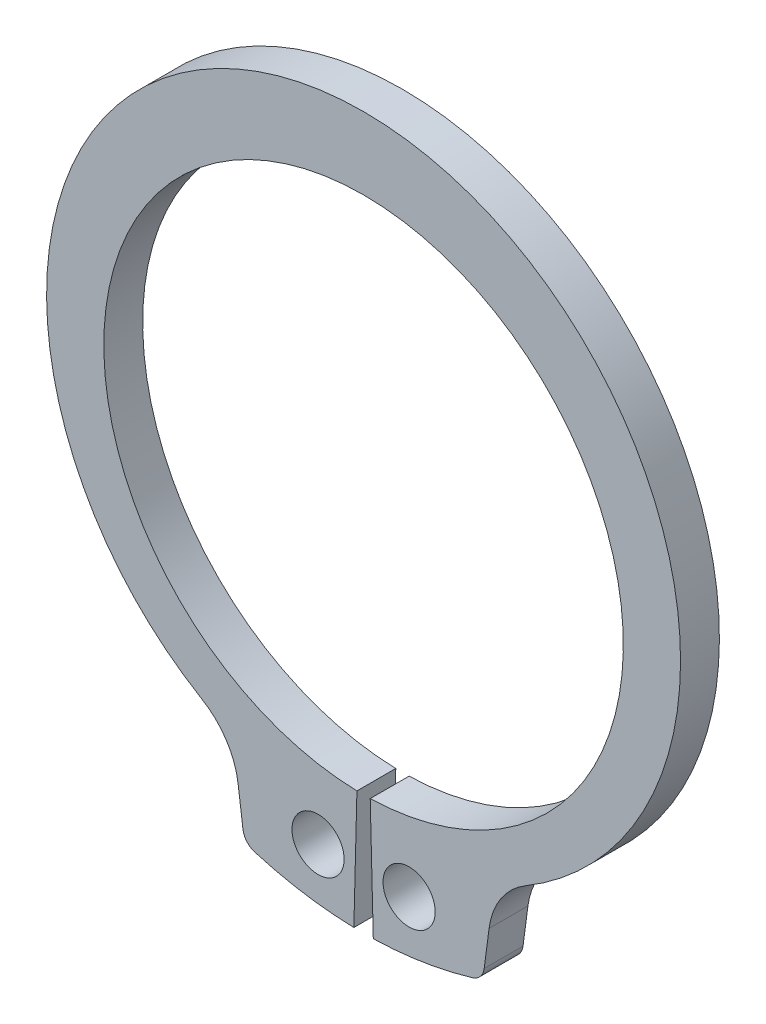
from build123d import *

# Parameters (mm, degrees)
BODYSKETCH_R = 0.5969
BODY_DEPTH   = 0.889


with BuildPart() as part:
    # BodySketch → Body (new body)
    with BuildSketch(Plane.XY):
        with BuildLine():
            Line((0.152065789, -5.941654396), (0.22225, -8.683956424))
            ThreePointArc((0.22225, -8.683956424), (1.368573357, -8.578315756), (2.490862191, -8.322024981))
            ThreePointArc((2.490862191, -8.322024981), (2.671680086, -8.204051371), (2.759354342, -8.006754365))
            Line((2.759354342, -8.006754365), (2.871664527, -7.153673811))
            ThreePointArc((2.871664527, -7.153673811), (3.142109784, -6.428451286), (3.702191114, -5.894225443))
            ThreePointArc((3.702191114, -5.894225443), (0, 7.5946), (-3.702191114, -5.894225443))
            ThreePointArc((-3.702191114, -5.894225443), (-3.142109784, -6.428451286), (-2.871664527, -7.153673811))
            Line((-2.871664527, -7.153673811), (-2.759354342, -8.006754365))
            ThreePointArc((-2.759354342, -8.006754365), (-2.671680086, -8.204051371), (-2.490862191, -8.322024981))
            ThreePointArc((-2.490862191, -8.322024981), (-1.368573357, -8.578315756), (-0.22225, -8.683956424))
            Line((-0.22225, -8.683956424), (-0.152065789, -5.941654396))
            ThreePointArc((-0.152065789, -5.941654396), (0, 5.9436), (0.152065789, -5.941654396))
        make_face()
        with Locations((1.0414, -7.445926712)):
            Circle(BODYSKETCH_R, mode=Mode.SUBTRACT)
        with Locations((-1.0414, -7.445926712)):
            Circle(BODYSKETCH_R, mode=Mode.SUBTRACT)
    extrude(amount=BODY_DEPTH)


solid = part.part
